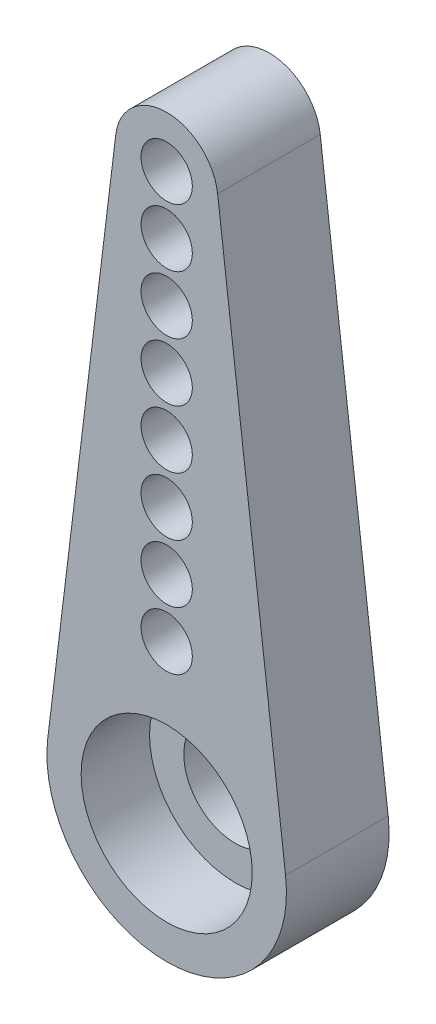
from build123d import *
from build123d.topology import SkipClean

# Parameters (mm, degrees)
SKETCH2_R           = 0.75
SKETCH2_R_2         = 1.5
BOSS_EXTRUDE1_DEPTH = 1
SKETCH2_3_R         = 2.5
SKETCH2_3_R_2       = 0.75
BOSS_EXTRUDE2_DEPTH = 3


with BuildPart() as part:
    # Sketch2 → Boss-Extrude1 (new body)
    with BuildSketch(Plane(origin=(0, 0, 0), x_dir=(0, 1, 0), z_dir=(0, 0, 1))):
        with BuildLine():
            Line((0.424242424, 3.474193196), (16.681818182, 1.488939941))
            ThreePointArc((16.681818182, 1.488939941), (18, 0), (16.681818182, -1.488939941))
            Line((16.681818182, -1.488939941), (0.424242424, -3.474193196))
            ThreePointArc((0.424242424, -3.474193196), (-3.5, 0), (0.424242424, 3.474193196))
        make_face()
        with Locations(Location((16.5, 0, 0), (0, 0, 270))):
            Circle(SKETCH2_R, mode=Mode.SUBTRACT)
        with Locations(Location((14.8, 0, 0), (0, 0, 270))):
            Circle(SKETCH2_R, mode=Mode.SUBTRACT)
        with Locations(Location((13.1, 0, 0), (0, 0, 270))):
            Circle(SKETCH2_R, mode=Mode.SUBTRACT)
        with Locations(Location((11.4, 0, 0), (0, 0, 270))):
            Circle(SKETCH2_R, mode=Mode.SUBTRACT)
        with Locations(Location((8, 0, 0), (0, 0, 270))):
            Circle(SKETCH2_R, mode=Mode.SUBTRACT)
        with Locations(Location((6.3, 0, 0), (0, 0, 270))):
            Circle(SKETCH2_R, mode=Mode.SUBTRACT)
        with Locations(Location((4.6, 0, 0), (0, 0, 270))):
            Circle(SKETCH2_R, mode=Mode.SUBTRACT)
        with Locations(Location((0, 0, 0), (0, 0, 270))):
            Circle(SKETCH2_R_2, mode=Mode.SUBTRACT)
    extrude(amount=BOSS_EXTRUDE1_DEPTH)

    # Sketch2<3> → Boss-Extrude2 (add)
    with SkipClean():  # the faces are left unmerged after this step: merging them gives an invalid solid
        with BuildSketch(Plane(origin=(0, 0, 0), x_dir=(0, 1, 0), z_dir=(0, 0, 1))):
            with BuildLine():
                ThreePointArc((0.424242424, 3.474193196), (-3.5, 0), (0.424242424, -3.474193196))
                Line((0.424242424, -3.474193196), (16.681818182, -1.488939941))
                ThreePointArc((16.681818182, -1.488939941), (18, 0), (16.681818182, 1.488939941))
                Line((16.681818182, 1.488939941), (0.424242424, 3.474193196))
            make_face()
            with Locations(Location((0, 0, 0), (0, 0, 270))):
                Circle(SKETCH2_3_R, mode=Mode.SUBTRACT)
            with Locations(Location((16.5, 0, 0), (0, 0, 270))):
                Circle(SKETCH2_3_R_2, mode=Mode.SUBTRACT)
            with Locations(Location((4.6, 0, 0), (0, 0, 270))):
                Circle(SKETCH2_3_R_2, mode=Mode.SUBTRACT)
            with Locations(Location((6.3, 0, 0), (0, 0, 270))):
                Circle(SKETCH2_3_R_2, mode=Mode.SUBTRACT)
            with Locations(Location((8, 0, 0), (0, 0, 270))):
                Circle(SKETCH2_3_R_2, mode=Mode.SUBTRACT)
            with Locations(Location((9.7, 0, 0), (0, 0, 270))):
                Circle(SKETCH2_3_R_2, mode=Mode.SUBTRACT)
            with Locations(Location((11.4, 0, 0), (0, 0, 270))):
                Circle(SKETCH2_3_R_2, mode=Mode.SUBTRACT)
            with Locations(Location((13.1, 0, 0), (0, 0, 270))):
                Circle(SKETCH2_3_R_2, mode=Mode.SUBTRACT)
            with Locations(Location((14.8, 0, 0), (0, 0, 270))):
                Circle(SKETCH2_3_R_2, mode=Mode.SUBTRACT)
        extrude(amount=BOSS_EXTRUDE2_DEPTH)


solid = part.part
